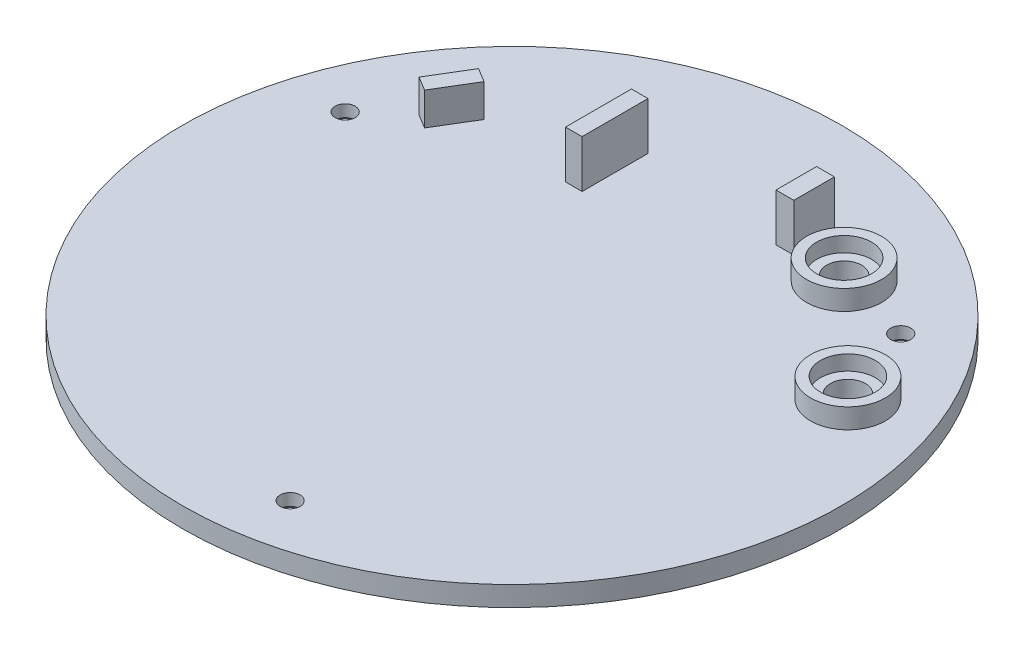
from build123d import *

# Parameters (mm, degrees)
SKETCH_1_R            = 33
EXTRUDE_1_DEPTH       = 2
SKETCH_5_W            = 1.656035281
SKETCH_5_H            = 6.604
SKETCH_5_W_2          = 1.787093918
SKETCH_5_H_2          = 4.064
EXTRUDE_2_DEPTH       = 4.76
EXTRUDE_3_DEPTH       = 3.283132799
SKETCH_8_R            = 3.75
SKETCH_8_R_2          = 1.75
EXTRUDE_4_DEPTH       = 2
SKETCH_9_R            = 1.75
CUT_EXTRUDE_3_DEPTH   = 2
CUT_EXTRUDE_START     = -1.5
SKETCH_10_R           = 2.75
SKETCH_10_R_2         = 1.75
CUT_EXTRUDE_1_DEPTH   = 1.5
SKETCH_11_R           = 2.75
SKETCH_11_R_2         = 1.75
CUT_EXTRUDE_2_DEPTH   = 1.5
SKETCH_12_R           = 1
CUT_EXTRUDE_4_DEPTH   = 2
SKETCH_13_R           = 2
SKETCH_13_R_2         = 1
CUT_EXTRUDE_3_2_DEPTH = 0.8


with BuildPart() as part:
    # 草图1 → 凸台-拉伸1 (new body)
    with BuildSketch(Plane.XZ.offset(12.25)):
        with Locations(Location((0, 0, 0), (0, 0, 270))):
            Circle(SKETCH_1_R)
    extrude(amount=EXTRUDE_1_DEPTH)

    # 草图5 → 凸台-拉伸2 (add)
    with BuildSketch(Plane(origin=(0, -12.25, 0), x_dir=(1, 0, 0), z_dir=(0, 1, 0))):
        with Locations((-8.069308352, 17.561156601)):
            Rectangle(SKETCH_5_W, SKETCH_5_H)
        with Locations((7.989127049, 21.371156601)):
            Rectangle(SKETCH_5_W_2, SKETCH_5_H_2)
    extrude(amount=EXTRUDE_2_DEPTH)

    # 草图6 → 凸台-拉伸3 (add)
    with BuildSketch(Plane(origin=(0, -12.25, 0), x_dir=(1, 0, 0), z_dir=(0, 1, 0))):
        Polygon((-22.046989488, 12.733470207), (-19.800612215, 16.450689742), (-18.391346743, 15.599047299), (-20.637724016, 11.881827764), align=None)
    extrude(amount=EXTRUDE_3_DEPTH)

    # 草图8 → 凸台-拉伸4 (add)
    # profile 1 of 2: a face of its own
    with BuildSketch(Plane(origin=(0, -12.25, 0), x_dir=(1, 0, 0), z_dir=(0, 1, 0))):
        with Locations(Location((13.635514667, 19.62057936, 0), (0, 0, 90))):
            Circle(SKETCH_8_R)
        with Locations(Location((13.635514667, 19.62057936, 0), (0, 0, 270))):
            Circle(SKETCH_8_R_2, mode=Mode.SUBTRACT)
    # profile 2 of 2: a face of its own
    with BuildSketch(Plane(origin=(0, -12.25, 0), x_dir=(1, 0, 0), z_dir=(0, 1, 0))):
        with Locations(Location((24.091410852, 9.546220913, 0), (0, 0, 90))):
            Circle(SKETCH_8_R)
        with Locations(Location((24.091410852, 9.546220913, 0), (0, 0, 270))):
            Circle(SKETCH_8_R_2, mode=Mode.SUBTRACT)
    extrude(amount=EXTRUDE_4_DEPTH)

    # 草图9 → Cut-Extrude 3 (cut)
    with BuildSketch(Plane.XZ.offset(14.25)):
        with Locations(Location((24.091410852, -9.546220913, 0), (0, 0, 270))):
            Circle(SKETCH_9_R)
        with Locations(Location((13.635514667, -19.62057936, 0), (0, 0, 270))):
            Circle(SKETCH_9_R)
    extrude(amount=-CUT_EXTRUDE_3_DEPTH, mode=Mode.SUBTRACT)

    # 草图10 → 切除-拉伸-薄壁1 (cut)
    with BuildSketch(Plane(origin=(0, -10.25, 0), x_dir=(1, 0, 0), z_dir=(0, 1, 0)).offset(CUT_EXTRUDE_START)):
        with Locations((13.635514667, 19.62057936)):
            Circle(SKETCH_10_R)
        with Locations((13.635514667, 19.62057936)):
            Circle(SKETCH_10_R_2, mode=Mode.SUBTRACT)
    extrude(amount=CUT_EXTRUDE_1_DEPTH, mode=Mode.SUBTRACT)

    # 草图11 → 切除-拉伸-薄壁2 (cut)
    with BuildSketch(Plane(origin=(0, -10.25, 0), x_dir=(1, 0, 0), z_dir=(0, 1, 0)).offset(CUT_EXTRUDE_START)):
        with Locations((24.091410852, 9.546220913)):
            Circle(SKETCH_11_R)
        with Locations((24.091410852, 9.546220913)):
            Circle(SKETCH_11_R_2, mode=Mode.SUBTRACT)
    extrude(amount=CUT_EXTRUDE_2_DEPTH, mode=Mode.SUBTRACT)

    # 草图12 → 切除-拉伸4 (cut)
    with BuildSketch(Plane.XZ.offset(14.25)):
        with Locations(Location((-26.0034734, -9.296556496, 0), (0, 0, 270))):
            Circle(SKETCH_12_R)
        with Locations(Location((4.950682607, 27.167946799, 0), (0, 0, 270))):
            Circle(SKETCH_12_R)
        with Locations(Location((21.052790793, -17.871390303, 0), (0, 0, 270))):
            Circle(SKETCH_12_R)
    extrude(amount=-CUT_EXTRUDE_4_DEPTH, mode=Mode.SUBTRACT)

    # 草图13 → Cut-Extrude 3 2 (cut)
    # profile 1 of 3: a face of its own
    with BuildSketch(Plane.XZ.offset(14.25)):
        with Locations((4.950682607, 27.167946799)):
            Circle(SKETCH_13_R)
        with Locations((4.950682607, 27.167946799)):
            Circle(SKETCH_13_R_2, mode=Mode.SUBTRACT)
    # profile 2 of 3: a face of its own
    with BuildSketch(Plane.XZ.offset(14.25)):
        with Locations((21.052790793, -17.871390303)):
            Circle(SKETCH_13_R)
        with Locations((21.052790793, -17.871390303)):
            Circle(SKETCH_13_R_2, mode=Mode.SUBTRACT)
    # profile 3 of 3: a face of its own
    with BuildSketch(Plane.XZ.offset(14.25)):
        with Locations((-26.0034734, -9.296556496)):
            Circle(SKETCH_13_R)
        with Locations((-26.0034734, -9.296556496)):
            Circle(SKETCH_13_R_2, mode=Mode.SUBTRACT)
    extrude(amount=-CUT_EXTRUDE_3_2_DEPTH, mode=Mode.SUBTRACT)


solid = part.part
